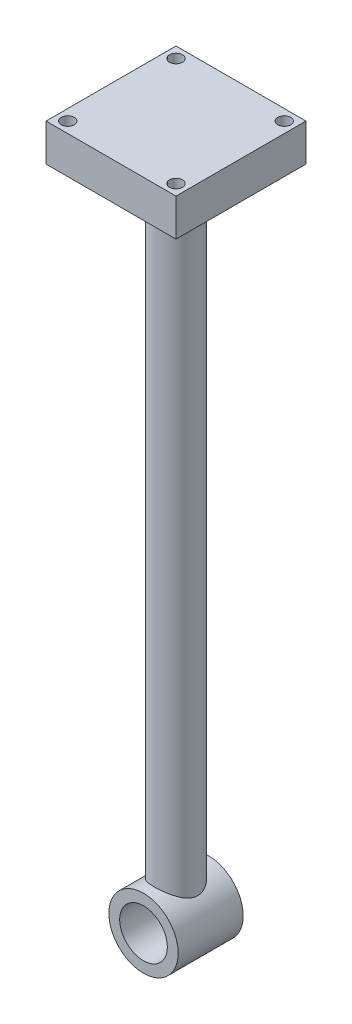
from build123d import *

# Parameters (mm, degrees)
SKETCH_1_R           = 8
SKETCH_1_R_2         = 5.5
EXTRUDE_1_DEPTH      = 7.5
EXTRUDE_2_REACH      = 160.38
EXTRUDE_2_END_RADIUS = 8
SKETCH_2_R           = 5
SKETCH_3_W           = 30
SKETCH_3_H           = 30
EXTRUDE_3_DEPTH      = 8.61101214
SKETCH_4_R           = 1.5
CUT_EXTRUDE_1_DEPTH  = 10


with BuildPart() as part:
    # 草图1 → 凸台-拉伸1 (new, symmetric)
    with BuildSketch(Plane.XY):
        Circle(SKETCH_1_R)
        Circle(SKETCH_1_R_2, mode=Mode.SUBTRACT)
    extrude(amount=EXTRUDE_1_DEPTH, both=True)

    # 凸台-拉伸2: up to this cylinder (the profile starts outside it)
    extrude_2_end = Plane(origin=(0, 0, 0), z_dir=(0, 0, -1)) * Cylinder(EXTRUDE_2_END_RADIUS, 337.76, mode=Mode.PRIVATE)
    # 草图2 → 凸台-拉伸2 (add, up to the surface)
    with BuildSketch(Plane(origin=(0, 150, 0), x_dir=(1, 0, 0), z_dir=(0, 1, 0)), mode=Mode.PRIVATE) as extrude_2_sk1:
        with Locations(Location((0, 0, 0), (0, 0, 270))):
            Circle(SKETCH_2_R)
    extrude_2_tool1 = extrude(extrude_2_sk1.sketch, amount=-EXTRUDE_2_REACH, mode=Mode.PRIVATE) - extrude_2_end
    add(extrude_2_tool1.solids().sort_by_distance((0, 150, 0))[0])

    # 草图3 → 凸台-拉伸3 (add)
    with BuildSketch(Plane(origin=(0, 150, 0), x_dir=(1, 0, 0), z_dir=(0, 1, 0))):
        Rectangle(SKETCH_3_W, SKETCH_3_H)
    extrude(amount=EXTRUDE_3_DEPTH)

    # 草图4 → 切除-拉伸1 (cut)
    with BuildSketch(Plane(origin=(0, 158.61101214, 0), x_dir=(1, 0, 0), z_dir=(0, 1, 0))):
        with Locations(Location((12.5, -12.5, 0), (0, 0, 270))):
            Circle(SKETCH_4_R)
        with Locations(Location((12.5, 12.5, 0), (0, 0, 270))):
            Circle(SKETCH_4_R)
        with Locations(Location((-12.5, -12.5, 0), (0, 0, 270))):
            Circle(SKETCH_4_R)
        with Locations(Location((-12.5, 12.5, 0), (0, 0, 270))):
            Circle(SKETCH_4_R)
    extrude(amount=-CUT_EXTRUDE_1_DEPTH, mode=Mode.SUBTRACT)


solid = part.part
